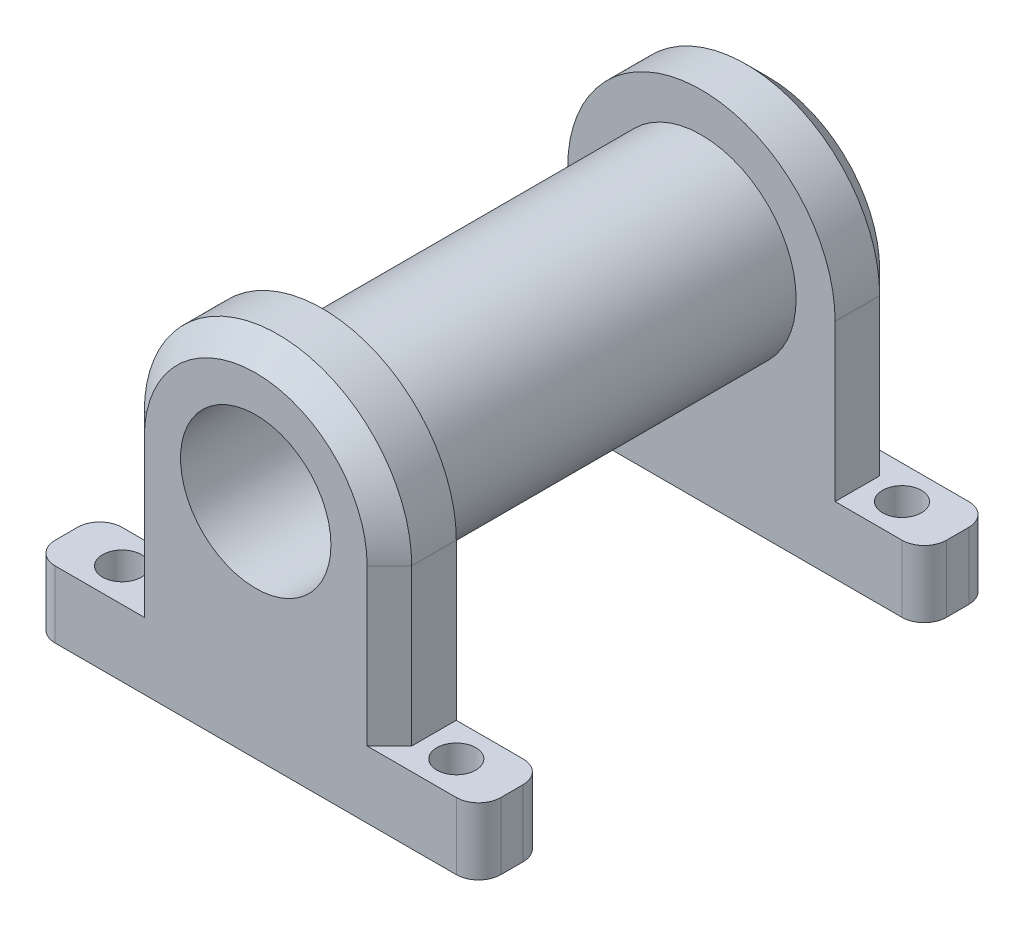
from build123d import *

# Parameters (mm, degrees)
BOSS_EXTRUDE1_DEPTH = 6
SKETCH2_R           = 8.5
BOSS_EXTRUDE2_DEPTH = 34
BOSS_EXTRUDE3_DEPTH = 6
SKETCH4_R           = 6.75
CUT_EXTRUDE1_DEPTH  = 55
SKETCH5_R           = 2.25
CUT_EXTRUDE2_DEPTH  = 13
SKETCH9_R           = 1.75
CUT_EXTRUDE5_DEPTH  = 57.497787567
FILLET1_R           = 2
CHAMFER4_SIZE       = 2


with BuildPart() as part:
    # Sketch1 → Boss-Extrude1 (new body)
    with BuildSketch(Plane.XY):
        with BuildLine():
            Line((-12, 0), (-12, -14))
            Line((-12, -14), (-20, -14))
            Line((-20, -14), (-20, -20))
            Line((-20, -20), (-12, -20))
            Line((-12, -20), (12, -20))
            Line((12, -20), (20, -20))
            Line((20, -20), (20, -14))
            Line((20, -14), (12, -14))
            Line((12, -14), (12, 0))
            ThreePointArc((12, 0), (0, 12), (-12, 0))
        make_face()
    extrude(amount=BOSS_EXTRUDE1_DEPTH)

    # Sketch2 → Boss-Extrude2 (add)
    with BuildSketch(Plane.XY.offset(6)):
        Circle(SKETCH2_R)
    extrude(amount=BOSS_EXTRUDE2_DEPTH)

    # Sketch3 → Boss-Extrude3 (add)
    with BuildSketch(Plane.XY.offset(40)):
        with BuildLine():
            Line((-12, 0), (-12, -14))
            Line((-12, -14), (-20, -14))
            Line((-20, -14), (-20, -20))
            Line((-20, -20), (20, -20))
            Line((20, -20), (20, -14))
            Line((20, -14), (12, -14))
            Line((12, -14), (12, 0))
            ThreePointArc((12, 0), (0, 12), (-12, 0))
        make_face()
    extrude(amount=BOSS_EXTRUDE3_DEPTH)

    # Sketch4 → Cut-Extrude1 (cut, through all)
    with BuildSketch(Plane.XY.offset(46)):
        Circle(SKETCH4_R)
    extrude(amount=-CUT_EXTRUDE1_DEPTH, mode=Mode.SUBTRACT)

    # Sketch5 → Cut-Extrude2 (cut)
    with BuildSketch(Plane.XZ.offset(20)):
        with Locations((-5, 43)):
            Circle(SKETCH5_R)
        with Locations((5, 43)):
            Circle(SKETCH5_R)
        with Locations((-5, 3)):
            Circle(SKETCH5_R)
        with Locations((5, 3)):
            Circle(SKETCH5_R)
    extrude(amount=-CUT_EXTRUDE2_DEPTH, mode=Mode.SUBTRACT)

    # Sketch9 → Cut-Extrude5 (cut, through all)
    with BuildSketch(Plane(origin=(0, -14, 0), x_dir=(1, 0, 0), z_dir=(0, 1, 0))):
        with Locations(Location((15, -43, 0), (0, 0, 270))):
            Circle(SKETCH9_R)
        with Locations(Location((-15, -43, 0), (0, 0, 270))):
            Circle(SKETCH9_R)
        with Locations(Location((15, -3, 0), (0, 0, 270))):
            Circle(SKETCH9_R)
        with Locations(Location((-15, -3, 0), (0, 0, 270))):
            Circle(SKETCH9_R)
    extrude(amount=-CUT_EXTRUDE5_DEPTH, mode=Mode.SUBTRACT)

    # Fillet1
    fillet1_edges = [part.edges().sort_by_distance(p)[0] for p in [
        (20, -17, 0),
        (-20, -17, 0),
        (20, -17, 6),
        (-20, -17, 40),
        (20, -17, 40),
        (-20, -17, 46),
        (20, -17, 46),
        (-20, -17, 6),
    ]]
    fillet(fillet1_edges, radius=FILLET1_R)

    # Chamfer4
    chamfer4_edges = [part.edges().sort_by_distance(p)[0] for p in [
        (-12, -7, 0),
        (0, 12, 0),
        (12, -7, 0),
        (12, -7, 46),
        (0, 12, 46),
        (-12, -7, 46),
    ]]
    chamfer(chamfer4_edges, length=CHAMFER4_SIZE)


solid = part.part
